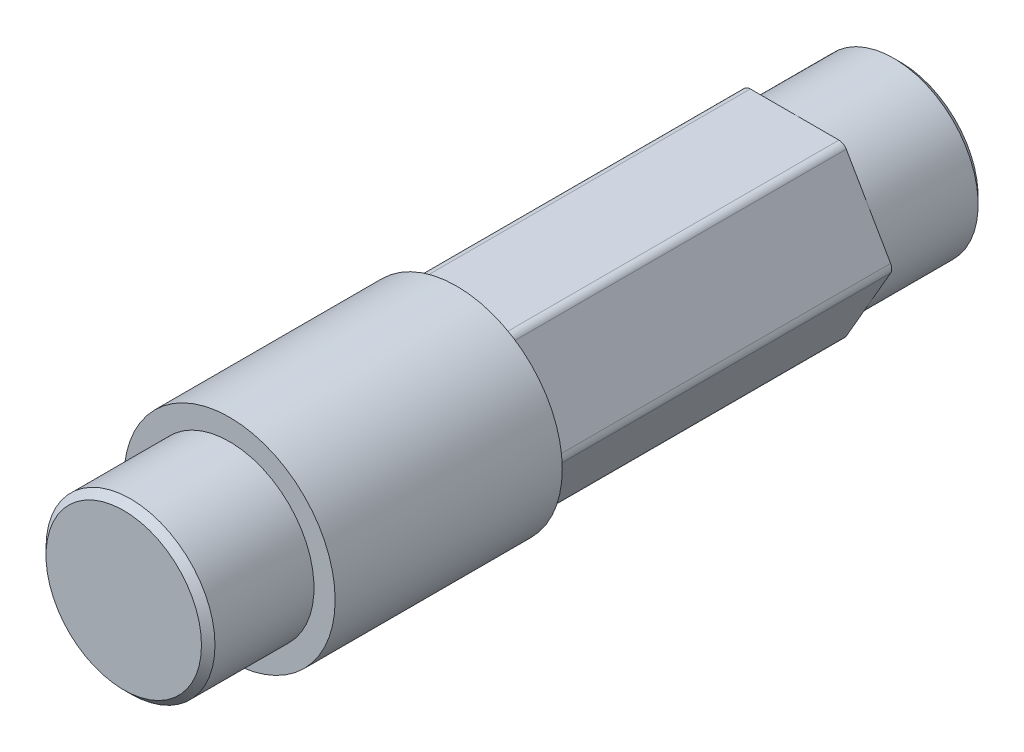
from build123d import *

# Parameters (mm, degrees)
SKETCH2_OUTSIDE_W  = 30.382
SKETCH2_OUTSIDE_H  = 30.382
CUT_EXTRUDE1_DEPTH = 25.4
CHAMFER1_SIZE      = 0.508
SKETCH3_R          = 3.175
CUT_EXTRUDE2_DEPTH = 6.858
FILLET1_R          = 0.635


with BuildPart() as part:
    # Sketch1 → Revolve1 (revolve)
    with BuildSketch(Plane(origin=(0, 0, 0), x_dir=(0, 0, -1), z_dir=(1, 0, 0)), mode=Mode.PRIVATE) as revolve1_sk:
        Polygon((-25.019, 0), (-25.019, 6.35), (-17.0688, 6.35), (-17.0688, 7.9375), (0, 7.9375), (0, 7.62), (25.4, 7.62), (25.4, 6.35), (33.3502, 6.35), (33.3502, 0), align=None)
    revolve(revolve1_sk.sketch.rotate(Axis((0, 0, 0), (0, 0, 1)), 90), axis=Axis((0, 0, 0), (0, 0, 1)))

    # Sketch2 outside → Cut-Extrude1 (cut)
    with BuildSketch(Plane(origin=(0, 0, -25.4), x_dir=(-1, 0, 0), z_dir=(0, 0, -1))):
        Rectangle(SKETCH2_OUTSIDE_W, SKETCH2_OUTSIDE_H)
        Polygon((3.696970073, 6.40334), (-3.696970073, 6.40334), (-7.393940145, 0), (-3.696970073, -6.40334), (3.696970073, -6.40334), (7.393940145, 0), align=None, mode=Mode.SUBTRACT)
    extrude(amount=-CUT_EXTRUDE1_DEPTH, mode=Mode.SUBTRACT)

    # Chamfer1
    chamfer1_edges = [part.edges().sort_by_distance(p)[0] for p in [
        (6.35, 0, 25.019),
        (6.35, 0, -33.3502),
    ]]
    chamfer(chamfer1_edges, length=CHAMFER1_SIZE)

    # Sketch3 → Cut-Extrude2 (cut)
    with BuildSketch(Plane(origin=(0, 0, -33.3502), x_dir=(-1, 0, 0), z_dir=(0, 0, -1))):
        Circle(SKETCH3_R)
    extrude(amount=-CUT_EXTRUDE2_DEPTH, mode=Mode.SUBTRACT)

    # Fillet1
    fillet1_edges = [part.edges().sort_by_distance(p)[0] for p in [
        (-3.696970073, 6.40334, -12.7),
        (3.696970073, 6.40334, -12.7),
        (7.393940145, 0, -12.7),
        (3.696970073, -6.40334, -12.7),
        (-3.696970073, -6.40334, -12.7),
        (-7.393940145, 0, -12.7),
    ]]
    fillet(fillet1_edges, radius=FILLET1_R)


solid = part.part
